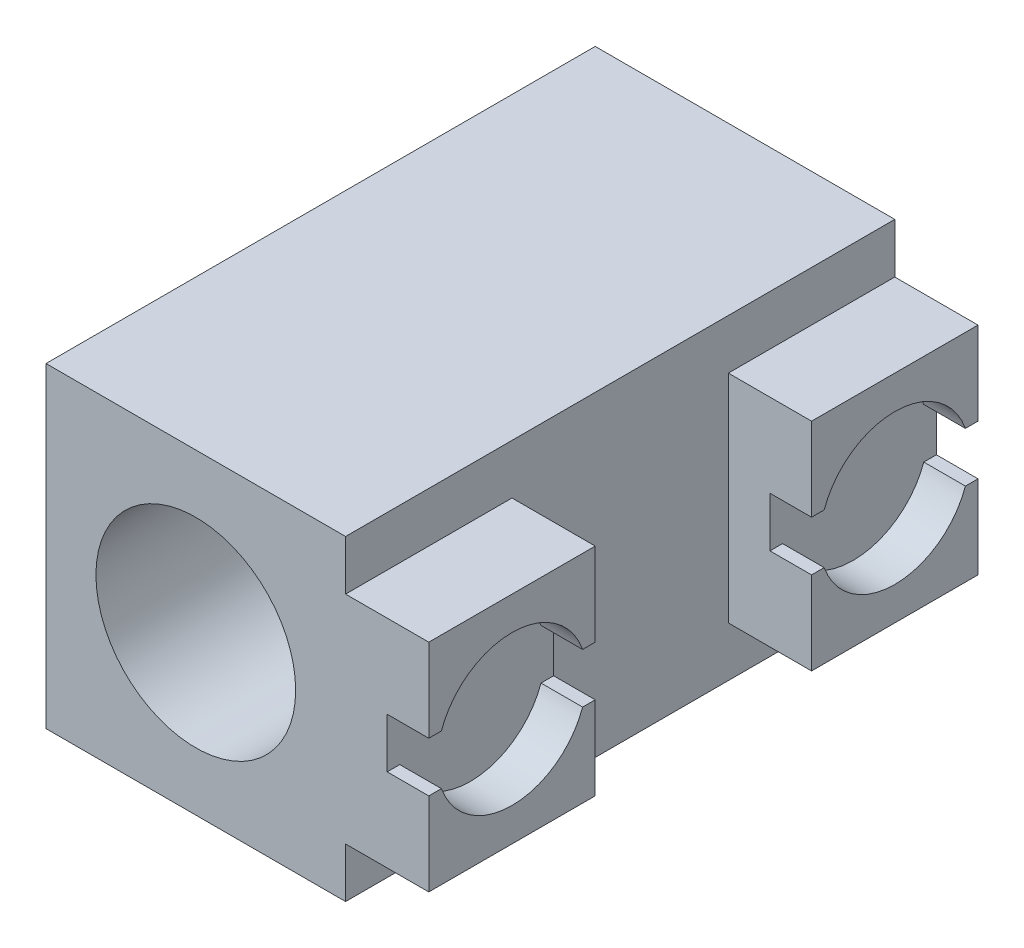
from build123d import *

# Parameters (mm, degrees)
SKETCH1_W           = 36
SKETCH1_H           = 38
BOSS_EXTRUDE1_DEPTH = 33
SKETCH2_R           = 12
CUT_EXTRUDE1_DEPTH  = 85.237758755
SKETCH3_W           = 20
SKETCH3_H           = 26
BOSS_EXTRUDE2_DEPTH = 10
SKETCH7_R           = 9
CUT_EXTRUDE4_DEPTH  = 5
CUT_EXTRUDE5_DEPTH  = 89.971905678


with BuildPart() as part:
    # Sketch1 → Boss-Extrude1 (new, symmetric)
    with BuildSketch(Plane.XY):
        with Locations((18, 19)):
            Rectangle(SKETCH1_W, SKETCH1_H)
    extrude(amount=BOSS_EXTRUDE1_DEPTH, both=True)

    # Sketch2 → Cut-Extrude1 (cut, through all)
    with BuildSketch(Plane.XY.offset(33)):
        with Locations((18, 19)):
            Circle(SKETCH2_R)
    extrude(amount=-CUT_EXTRUDE1_DEPTH, mode=Mode.SUBTRACT)

    # Sketch3 → Boss-Extrude2 (add)
    with BuildSketch(Plane(origin=(36, 0, 0), x_dir=(0, 0, -1), z_dir=(1, 0, 0))):
        with Locations((-23, 19)):
            Rectangle(SKETCH3_W, SKETCH3_H)
        with Locations((23, 19)):
            Rectangle(SKETCH3_W, SKETCH3_H)
    extrude(amount=BOSS_EXTRUDE2_DEPTH)

    # Sketch7 → Cut-Extrude4 (cut)
    with BuildSketch(Plane(origin=(46, 0, 0), x_dir=(0, 0, -1), z_dir=(1, 0, 0))):
        with Locations(Location((-23, 19, 0), (0, 0, 90))):
            Circle(SKETCH7_R)
        with Locations(Location((23, 19, 0), (0, 0, 90))):
            Circle(SKETCH7_R)
    extrude(amount=-CUT_EXTRUDE4_DEPTH, mode=Mode.SUBTRACT)

    # Sketch8 → Cut-Extrude5 (cut, through all)
    with BuildSketch(Plane.XY.offset(33)):
        Polygon((46, 19), (46, 22), (41, 22), (41, 16), (46, 16), align=None)
    extrude(amount=-CUT_EXTRUDE5_DEPTH, mode=Mode.SUBTRACT)


solid = part.part
